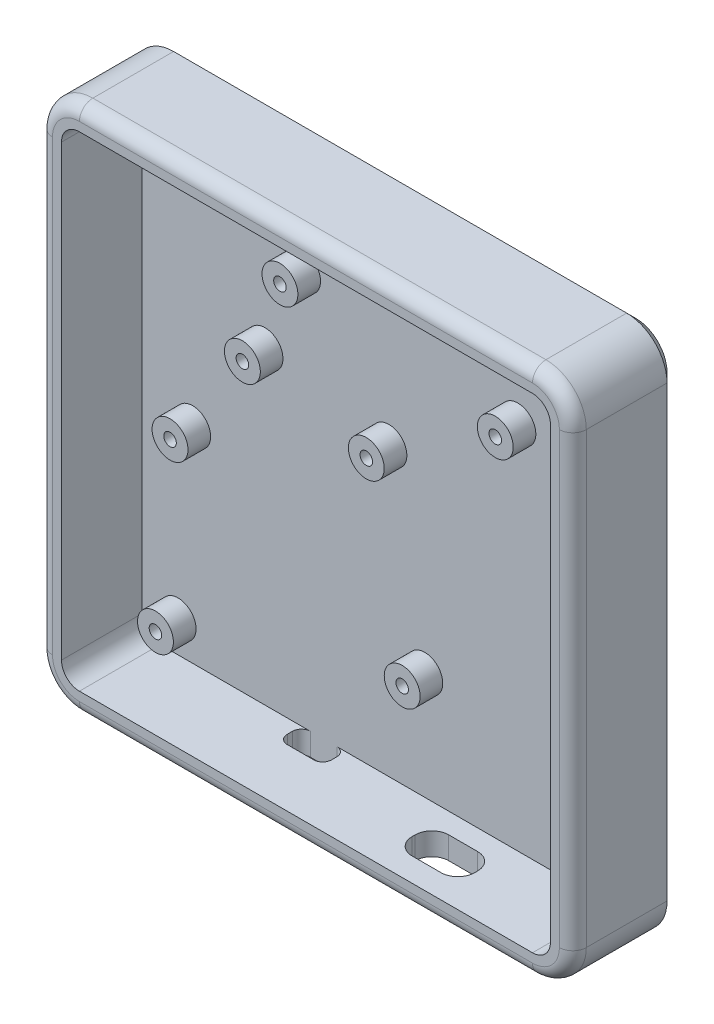
from build123d import *

# Parameters (mm, degrees)
BOSS_EXTRUDE1_DEPTH   = 18
SKETCH2_R             = 4
BOSS_EXTRUDE2_DEPTH   = 5.044559182
BOSS_EXTRUDE2_2_DEPTH = 5.044559182
BOSS_EXTRUDE2_3_DEPTH = 5.044559182
BOSS_EXTRUDE2_4_DEPTH = 5.044559182
BOSS_EXTRUDE2_5_DEPTH = 5.044559182
BOSS_EXTRUDE2_6_DEPTH = 5.044559182
BOSS_EXTRUDE2_7_DEPTH = 5.044559182
BOSS_EXTRUDE2_8_DEPTH = 5.044559182
BOSS_EXTRUDE4_DEPTH   = 5
CHAMFER1_SIZE         = 2
CUT_EXTRUDE4_DEPTH    = 10
CUT_EXTRUDE5_START    = -5.044562
SKETCH9_R             = 1.4
CUT_EXTRUDE5_DEPTH    = 5.044563
FILLET1_R             = 3


with BuildPart() as part:
    # Sketch1 → Boss-Extrude1 (new body)
    with BuildSketch(Plane.XY):
        with BuildLine():
            Line((23.631203293, 52.499999142), (23.631198922, -47.500000858))
            ThreePointArc((23.631198922, -47.500000858), (26.267237752, -53.863962143), (32.631198922, -56.500001252))
            Line((32.631198922, -56.500001252), (133.631203293, -56.500001252))
            ThreePointArc((133.631203293, -56.500001252), (139.995164324, -53.863962282), (142.631203293, -47.500001252))
            Line((142.631203293, -47.500001252), (142.631203293, 52.499998748))
            ThreePointArc((142.631203293, 52.499998748), (139.995164324, 58.863959779), (133.631203293, 61.499998748))
            Line((133.631203293, 61.499998748), (32.631203293, 61.499998748))
            ThreePointArc((32.631203293, 61.499998748), (26.267242401, 58.863959918), (23.631203293, 52.499999142))
        make_face()
        with BuildLine():
            Line((28.631203141, 52.499998748), (28.63119877, -47.500001252))
            ThreePointArc((28.63119877, -47.500001252), (29.80277169, -50.328428483), (32.631198922, -51.500001252))
            Line((32.631198922, -51.500001252), (133.631203293, -51.500001252))
            ThreePointArc((133.631203293, -51.500001252), (136.459630418, -50.328428376), (137.631203293, -47.500001252))
            Line((137.631203293, -47.500001252), (137.631203293, 52.499998748))
            ThreePointArc((137.631203293, 52.499998748), (136.459630418, 55.328425873), (133.631203293, 56.499998748))
            Line((133.631203293, 56.499998748), (32.631203293, 56.499998748))
            ThreePointArc((32.631203293, 56.499998748), (29.802776168, 55.328425873), (28.631203141, 52.499998748))
        make_face(mode=Mode.SUBTRACT)
    extrude(amount=-BOSS_EXTRUDE1_DEPTH)

    # Sketch6 → Boss-Extrude4 (add)
    with BuildSketch(Plane(origin=(0, 0, -18), x_dir=(-1, 0, 0), z_dir=(0, 0, -1))):
        with BuildLine():
            Line((-23.631198922, -47.500000858), (-23.631203293, 52.499999142))
            ThreePointArc((-23.631203293, 52.499999142), (-26.267242401, 58.863959918), (-32.631203293, 61.499998748))
            Line((-32.631203293, 61.499998748), (-133.631203293, 61.499998748))
            ThreePointArc((-133.631203293, 61.499998748), (-139.995164324, 58.863959779), (-142.631203293, 52.499998748))
            Line((-142.631203293, 52.499998748), (-142.631203293, -47.500001252))
            ThreePointArc((-142.631203293, -47.500001252), (-139.995164324, -53.863962282), (-133.631203293, -56.500001252))
            Line((-133.631203293, -56.500001252), (-32.631198922, -56.500001252))
            ThreePointArc((-32.631198922, -56.500001252), (-26.267237752, -53.863962143), (-23.631198922, -47.500000858))
        make_face()
    extrude(amount=BOSS_EXTRUDE4_DEPTH)

    # Chamfer1
    chamfer1_edges = [part.edges().sort_by_distance(p)[0] for p in [
        (26.267237752, -53.863962143, -23),
        (23.631201107, 2.499999142, -23),
        (26.267242401, 58.863959918, -23),
        (83.131203293, 61.499998748, -23),
        (139.995164324, 58.863959779, -23),
        (142.631203293, 2.499998748, -23),
        (139.995164324, -53.863962282, -23),
        (83.131201107, -56.500001252, -23),
    ]]
    chamfer(chamfer1_edges, length=CHAMFER1_SIZE)

    # Sketch8 → Cut-Extrude4 (cut)
    # profile 1 of 3: a face of its own
    with BuildSketch(Plane(origin=(0, -56.500001252, 0), x_dir=(1, 0, 0), z_dir=(0, 1, 0))):
        with BuildLine():
            ThreePointArc((97.786242074, 9.020000419), (98.884591644, 6.368349989), (101.536242074, 5.270000419))
            Line((101.536242074, 5.270000419), (107.976242074, 5.270000419))
            ThreePointArc((107.976242074, 5.270000419), (110.627892503, 6.368349989), (111.726242074, 9.020000419))
            Line((111.726242074, 9.020000419), (111.726242074, 9.680000419))
            ThreePointArc((111.726242074, 9.680000419), (110.627892503, 12.331650848), (107.976242074, 13.430000419))
            Line((107.976242074, 13.430000419), (104.477997177, 13.430000419))
            Line((104.477997177, 13.430000419), (101.536242074, 13.430000419))
            ThreePointArc((101.536242074, 13.430000419), (98.884591644, 12.331650848), (97.786242074, 9.680000419))
            Line((97.786242074, 9.680000419), (97.786242074, 9.020000419))
        make_face()
        with BuildLine():
            Line((101.536242074, 7.770000419), (107.976242074, 7.770000419))
            ThreePointArc((107.976242074, 7.770000419), (108.86012555, 8.136116942), (109.226242074, 9.020000419))
            Line((109.226242074, 9.020000419), (109.226242074, 9.680000419))
            ThreePointArc((109.226242074, 9.680000419), (108.86012555, 10.563883895), (107.976242074, 10.930000419))
            Line((107.976242074, 10.930000419), (104.487997177, 10.930000419))
            Line((104.487997177, 10.930000419), (104.487997177, 10.730000419))
            Line((104.487997177, 10.730000419), (107.976242074, 10.730000419))
            ThreePointArc((107.976242074, 10.730000419), (108.718704194, 10.422462539), (109.026242074, 9.680000419))
            Line((109.026242074, 9.680000419), (109.026242074, 9.020000419))
            ThreePointArc((109.026242074, 9.020000419), (108.718704194, 8.277538299), (107.976242074, 7.970000419))
            Line((107.976242074, 7.970000419), (101.536242074, 7.970000419))
            ThreePointArc((101.536242074, 7.970000419), (100.793779953, 8.277538299), (100.486242074, 9.020000419))
            Line((100.486242074, 9.020000419), (100.486242074, 9.680000419))
            ThreePointArc((100.486242074, 9.680000419), (100.793779953, 10.422462539), (101.536242074, 10.730000419))
            Line((101.536242074, 10.730000419), (104.467997177, 10.730000419))
            Line((104.467997177, 10.730000419), (104.467997177, 10.930000419))
            Line((104.467997177, 10.930000419), (101.536242074, 10.930000419))
            ThreePointArc((101.536242074, 10.930000419), (100.652358597, 10.563883895), (100.286242074, 9.680000419))
            Line((100.286242074, 9.680000419), (100.286242074, 9.020000419))
            ThreePointArc((100.286242074, 9.020000419), (100.652358597, 8.136116942), (101.536242074, 7.770000419))
        make_face(mode=Mode.SUBTRACT)
    # profile 2 of 3: a face of its own
    with BuildSketch(Plane(origin=(0, -56.500001252, 0), x_dir=(1, 0, 0), z_dir=(0, 1, 0))):
        with BuildLine():
            ThreePointArc((107.976242074, 7.770000419), (108.86012555, 8.136116942), (109.226242074, 9.020000419))
            Line((109.226242074, 9.020000419), (109.226242074, 9.680000419))
            ThreePointArc((109.226242074, 9.680000419), (108.86012555, 10.563883895), (107.976242074, 10.930000419))
            Line((107.976242074, 10.930000419), (104.487997177, 10.930000419))
            Line((104.487997177, 10.930000419), (104.487997177, 10.730000419))
            Line((104.487997177, 10.730000419), (107.976242074, 10.730000419))
            ThreePointArc((107.976242074, 10.730000419), (108.718704194, 10.422462539), (109.026242074, 9.680000419))
            Line((109.026242074, 9.680000419), (109.026242074, 9.020000419))
            ThreePointArc((109.026242074, 9.020000419), (108.718704194, 8.277538299), (107.976242074, 7.970000419))
            Line((107.976242074, 7.970000419), (101.536242074, 7.970000419))
            ThreePointArc((101.536242074, 7.970000419), (100.793779953, 8.277538299), (100.486242074, 9.020000419))
            Line((100.486242074, 9.020000419), (100.486242074, 9.680000419))
            ThreePointArc((100.486242074, 9.680000419), (100.793779953, 10.422462539), (101.536242074, 10.730000419))
            Line((101.536242074, 10.730000419), (104.467997177, 10.730000419))
            Line((104.467997177, 10.730000419), (104.467997177, 10.930000419))
            Line((104.467997177, 10.930000419), (101.536242074, 10.930000419))
            ThreePointArc((101.536242074, 10.930000419), (100.652358597, 10.563883895), (100.286242074, 9.680000419))
            Line((100.286242074, 9.680000419), (100.286242074, 9.020000419))
            ThreePointArc((100.286242074, 9.020000419), (100.652358597, 8.136116942), (101.536242074, 7.770000419))
            Line((101.536242074, 7.770000419), (107.976242074, 7.770000419))
        make_face()
    # profile 3 of 3: a face of its own
    with BuildSketch(Plane(origin=(0, -56.500001252, 0), x_dir=(1, 0, 0), z_dir=(0, 1, 0))):
        with BuildLine():
            Line((72, 12.855738996), (66.115223507, 12.855738996))
            ThreePointArc((66.115223507, 12.855738996), (64.701009945, 13.441525434), (64.115223507, 14.855738996))
            Line((64.115223507, 14.855738996), (64.115223507, 16))
            ThreePointArc((64.115223507, 16), (64.701009945, 17.414213562), (66.115223507, 18))
            Line((66.115223507, 18), (72, 18))
            ThreePointArc((72, 18), (73.414213562, 17.414213562), (74, 16))
            Line((74, 16), (74, 14.855738996))
            ThreePointArc((74, 14.855738996), (73.414213562, 13.441525434), (72, 12.855738996))
        make_face()
    extrude(amount=CUT_EXTRUDE4_DEPTH, mode=Mode.SUBTRACT)

    # Fillet1
    fillet1_edges = [part.edges().sort_by_distance(p)[0] for p in [
        (142.631203293, 2.499998748, 0),
        (139.995164324, -53.863962282, 0),
        (83.131201107, -56.500001252, 0),
        (26.267237752, -53.863962143, 0),
        (23.631201107, 2.499999142, 0),
        (26.267242401, 58.863959918, 0),
        (83.131203293, 61.499998748, 0),
        (139.995164324, 58.863959779, 0),
    ]]
    fillet(fillet1_edges, radius=FILLET1_R)


with BuildPart() as body_2:
    # Sketch2 → Boss-Extrude2 (new body)
    with BuildSketch(Plane(origin=(0, 0, -18), x_dir=(-1, 0, 0), z_dir=(0, 0, -1))):
        with Locations((-112.381202333, 30.999995568)):
            Circle(SKETCH2_R)
    extrude(amount=-BOSS_EXTRUDE2_DEPTH)


with BuildPart() as body_3:
    # Sketch2 → Boss-Extrude2 2 (new body)
    with BuildSketch(Plane(origin=(0, 0, -18), x_dir=(-1, 0, 0), z_dir=(0, 0, -1))):
        with Locations((-64.381202053, 36.499996826)):
            Circle(SKETCH2_R)
    extrude(amount=-BOSS_EXTRUDE2_2_DEPTH)


with BuildPart() as body_4:
    # Sketch2 → Boss-Extrude2 3 (new body)
    with BuildSketch(Plane(origin=(0, 0, -18), x_dir=(-1, 0, 0), z_dir=(0, 0, -1))):
        with Locations((-56.006201457, 17.374998612)):
            Circle(SKETCH2_R)
    extrude(amount=-BOSS_EXTRUDE2_3_DEPTH)


with BuildPart() as body_5:
    # Sketch2 → Boss-Extrude2 4 (new body)
    with BuildSketch(Plane(origin=(0, 0, -18), x_dir=(-1, 0, 0), z_dir=(0, 0, -1))):
        with Locations((-83.631200604, 12.499995724)):
            Circle(SKETCH2_R)
    extrude(amount=-BOSS_EXTRUDE2_4_DEPTH)


with BuildPart() as body_6:
    # Sketch2 → Boss-Extrude2 5 (new body)
    with BuildSketch(Plane(origin=(0, 0, -18), x_dir=(-1, 0, 0), z_dir=(0, 0, -1))):
        with Locations((-39.881200947, -5.750001423)):
            Circle(SKETCH2_R)
    extrude(amount=-BOSS_EXTRUDE2_5_DEPTH)


with BuildPart() as body_7:
    # Sketch2 → Boss-Extrude2 6 (new body)
    with BuildSketch(Plane(origin=(0, 0, -18), x_dir=(-1, 0, 0), z_dir=(0, 0, -1))):
        with Locations((-36.631198133, -44.500002521)):
            Circle(SKETCH2_R)
    extrude(amount=-BOSS_EXTRUDE2_6_DEPTH)


with BuildPart() as body_8:
    # Sketch2 → Boss-Extrude2 7 (new body)
    with BuildSketch(Plane(origin=(0, 0, -18), x_dir=(-1, 0, 0), z_dir=(0, 0, -1))):
        with Locations((-130.631198093, -44.50000663)):
            Circle(SKETCH2_R)
    extrude(amount=-BOSS_EXTRUDE2_7_DEPTH)


with BuildPart() as body_9:
    # Sketch2 → Boss-Extrude2 8 (new body)
    with BuildSketch(Plane(origin=(0, 0, -18), x_dir=(-1, 0, 0), z_dir=(0, 0, -1))):
        with Locations((-91.631200636, -27.500003365)):
            Circle(SKETCH2_R)
    extrude(amount=-BOSS_EXTRUDE2_8_DEPTH)


with BuildPart() as cut_extrude5_tool:
    # Sketch9 → Cut-Extrude5 (new body)
    with BuildSketch(Plane(origin=(-5.66e-07, 0, -12.95543608), x_dir=(0.999999999999999, 0, -4.371138828673993e-08), z_dir=(4.371138828673993e-08, -1.389432378091647e-15, 0.9999999999999991)).offset(CUT_EXTRUDE5_START)):
        with Locations((130.631198659, -44.50000663)):
            Circle(SKETCH9_R)
        with Locations((36.631198699, -44.500002521)):
            Circle(SKETCH9_R)
        with Locations((91.631201202, -27.500003365)):
            Circle(SKETCH9_R)
        with Locations((83.631201171, 12.499995724)):
            Circle(SKETCH9_R)
        with Locations((56.006202024, 17.374998612)):
            Circle(SKETCH9_R)
        with Locations((39.881201513, -5.750001423)):
            Circle(SKETCH9_R)
        with Locations((112.381202899, 30.999995568)):
            Circle(SKETCH9_R)
        with Locations((64.38120262, 36.499996826)):
            Circle(SKETCH9_R)
    extrude(amount=CUT_EXTRUDE5_DEPTH)


with BuildPart() as body_2_1:
    add(body_2.part)

    # Cut-Extrude5: cut by cut_extrude5_tool
    add(cut_extrude5_tool.part, mode=Mode.SUBTRACT)


with BuildPart() as body_3_1:
    add(body_3.part)

    # Cut-Extrude5: cut by cut_extrude5_tool
    add(cut_extrude5_tool.part, mode=Mode.SUBTRACT)


with BuildPart() as body_4_1:
    add(body_4.part)

    # Cut-Extrude5: cut by cut_extrude5_tool
    add(cut_extrude5_tool.part, mode=Mode.SUBTRACT)


with BuildPart() as body_5_1:
    add(body_5.part)

    # Cut-Extrude5: cut by cut_extrude5_tool
    add(cut_extrude5_tool.part, mode=Mode.SUBTRACT)


with BuildPart() as body_6_1:
    add(body_6.part)

    # Cut-Extrude5: cut by cut_extrude5_tool
    add(cut_extrude5_tool.part, mode=Mode.SUBTRACT)


with BuildPart() as body_7_1:
    add(body_7.part)

    # Cut-Extrude5: cut by cut_extrude5_tool
    add(cut_extrude5_tool.part, mode=Mode.SUBTRACT)


with BuildPart() as body_8_1:
    add(body_8.part)

    # Cut-Extrude5: cut by cut_extrude5_tool
    add(cut_extrude5_tool.part, mode=Mode.SUBTRACT)


with BuildPart() as body_9_1:
    add(body_9.part)

    # Cut-Extrude5: cut by cut_extrude5_tool
    add(cut_extrude5_tool.part, mode=Mode.SUBTRACT)


solid = Compound([part.part, body_2_1.part, body_3_1.part, body_4_1.part, body_5_1.part, body_6_1.part, body_7_1.part, body_8_1.part, body_9_1.part])
